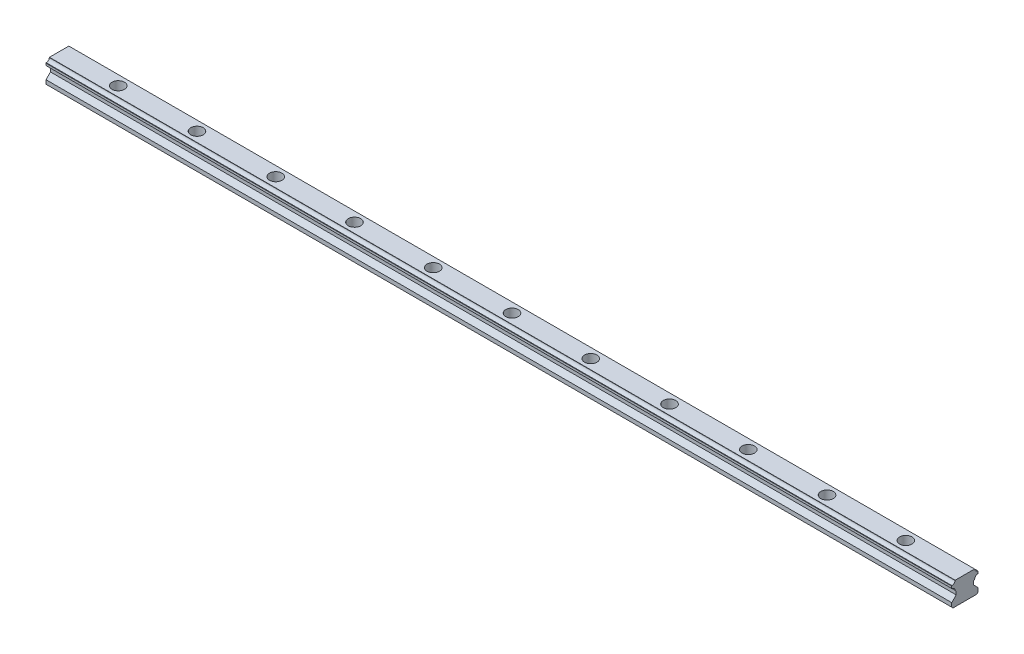
from build123d import *

# Parameters (mm, degrees)
EXTRUDE_1_DEPTH                  = 345
HOLE_WIZARD_M6_78051_D           = 6
HOLE_WIZARD_M6_78051_CBORE_D     = 9.5
HOLE_WIZARD_M6_78051_CBORE_DEPTH = 8.5
PATTERN_LINEAR_1_COUNT           = 6
PATTERN_LINEAR_1_PITCH           = 60
PATTERN_LINEAR_2_COUNT           = 6
PATTERN_LINEAR_2_PITCH           = 60


with BuildPart() as part:
    # Эскиз1 → Бобышка-Вытянуть1 (new, symmetric)
    with BuildSketch(Plane(origin=(0, 0, 0), x_dir=(0, 0, -1), z_dir=(1, 0, 0))):
        with BuildLine():
            Line((-10, 0.989949494), (-9.010050506, 0))
            Line((-9.010050506, 0), (9.010050506, 0))
            Line((9.010050506, 0), (10, 0.989949494))
            Line((10, 0.989949494), (10, 4))
            Line((10, 4), (6.6, 7.4))
            Line((6.6, 7.4), (6.6, 9.9))
            Line((6.6, 9.9), (7.5, 10.8))
            ThreePointArc((7.5, 10.8), (8.173654403, 12.426345597), (9.8, 13.1))
            Line((9.8, 13.1), (10, 13.3))
            Line((10, 13.3), (10, 14.9))
            Line((10, 14.9), (9.8, 15.1))
            ThreePointArc((9.8, 15.1), (8.173654403, 15.773654403), (7.5, 17.4))
            Line((7.5, 17.4), (7.4, 17.5))
            Line((7.4, 17.5), (-7.4, 17.5))
            Line((-7.4, 17.5), (-7.5, 17.4))
            ThreePointArc((-7.5, 17.4), (-8.173654403, 15.773654403), (-9.8, 15.1))
            Line((-9.8, 15.1), (-10, 14.9))
            Line((-10, 14.9), (-10, 13.3))
            Line((-10, 13.3), (-9.8, 13.1))
            ThreePointArc((-9.8, 13.1), (-8.173654403, 12.426345597), (-7.5, 10.8))
            Line((-7.5, 10.8), (-6.6, 9.9))
            Line((-6.6, 9.9), (-6.6, 7.4))
            Line((-6.6, 7.4), (-10, 4))
            Line((-10, 4), (-10, 0.989949494))
        make_face()
    extrude(amount=EXTRUDE_1_DEPTH, both=True)

    # Цековка M6 для болта с шестигранной головкой класса А ГОСТ 78051 (through all)
    with Locations(Plane.ZX.offset(17.5)):
        with Locations((0, 0)):
            hole_wizard_m6_78051 = CounterBoreHole(HOLE_WIZARD_M6_78051_D / 2, HOLE_WIZARD_M6_78051_CBORE_D / 2, HOLE_WIZARD_M6_78051_CBORE_DEPTH)

    # Линейный массив1: Цековка M6 для болта с шестигранной головкой класса А ГОСТ 78051 ×6
    with Locations(*[(i * PATTERN_LINEAR_1_PITCH, 0, 0) for i in range(1, PATTERN_LINEAR_1_COUNT)]):
        add(hole_wizard_m6_78051, mode=Mode.SUBTRACT)

    # Линейный массив2: Цековка M6 для болта с шестигранной головкой класса А ГОСТ 78051 ×6
    with Locations(*[(-i * PATTERN_LINEAR_2_PITCH, 0, 0) for i in range(1, PATTERN_LINEAR_2_COUNT)]):
        add(hole_wizard_m6_78051, mode=Mode.SUBTRACT)


solid = part.part
